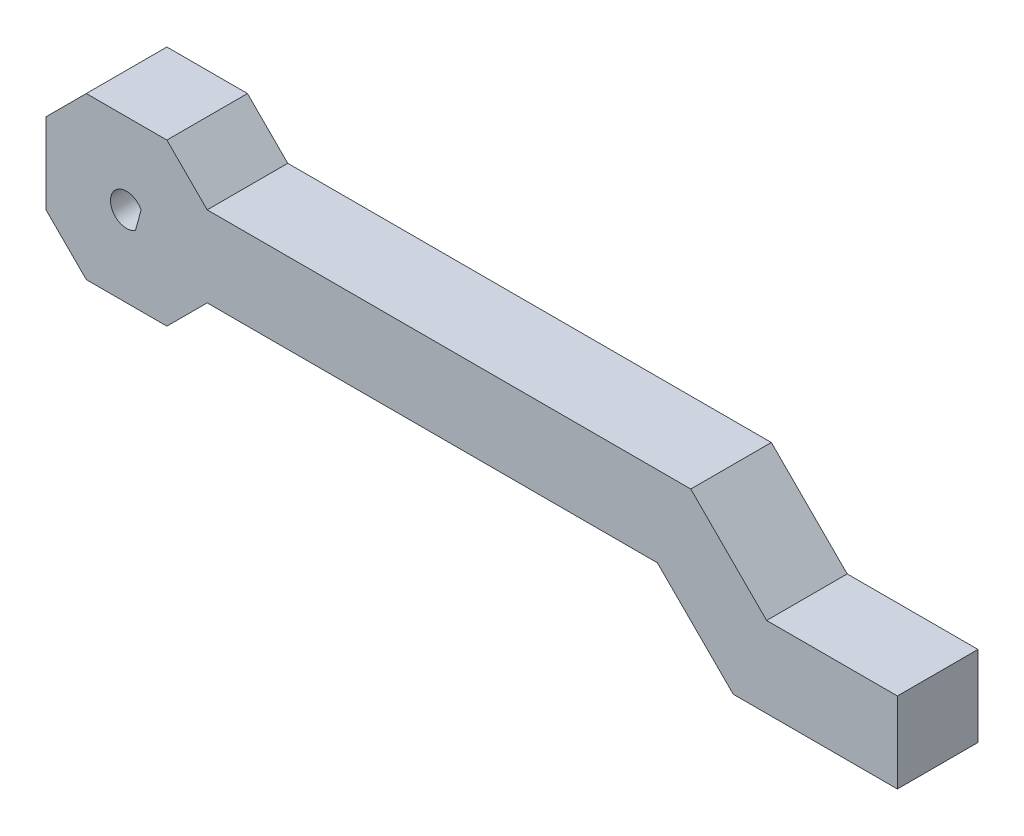
from build123d import *

# Parameters (mm, degrees)
BOSS_EXTRUDE1_DEPTH = 20


with BuildPart() as part:
    # Sketch1 → Boss-Extrude1 (new body)
    with BuildSketch(Plane.XY):
        Polygon((-125.92552771, 40.003004944), (-115.92552771, 50.003004944), (-95.92552771, 50.003004944), (-85.92552771, 40.003003647), (34.07447229, 40.003003647), (52.904699458, 21.17277648), (85.359896376, 21.17277648), (85.359896376, 1.17277648), (44.62042821, 1.17277648), (25.790201043, 20.003003647), (-85.92552771, 20.003003647), (-95.92552771, 10.003004944), (-115.92552771, 10.003004944), (-125.92552771, 20.003004944), align=None)
        with BuildLine():
            Line((-103.718736643, 26.666828512), (-102.339668887, 31.775465524))
            ThreePointArc((-102.339668887, 31.775465524), (-109.787294302, 31.04548218), (-103.718736643, 26.666828512))
        make_face(mode=Mode.SUBTRACT)
    extrude(amount=BOSS_EXTRUDE1_DEPTH)


solid = part.part
